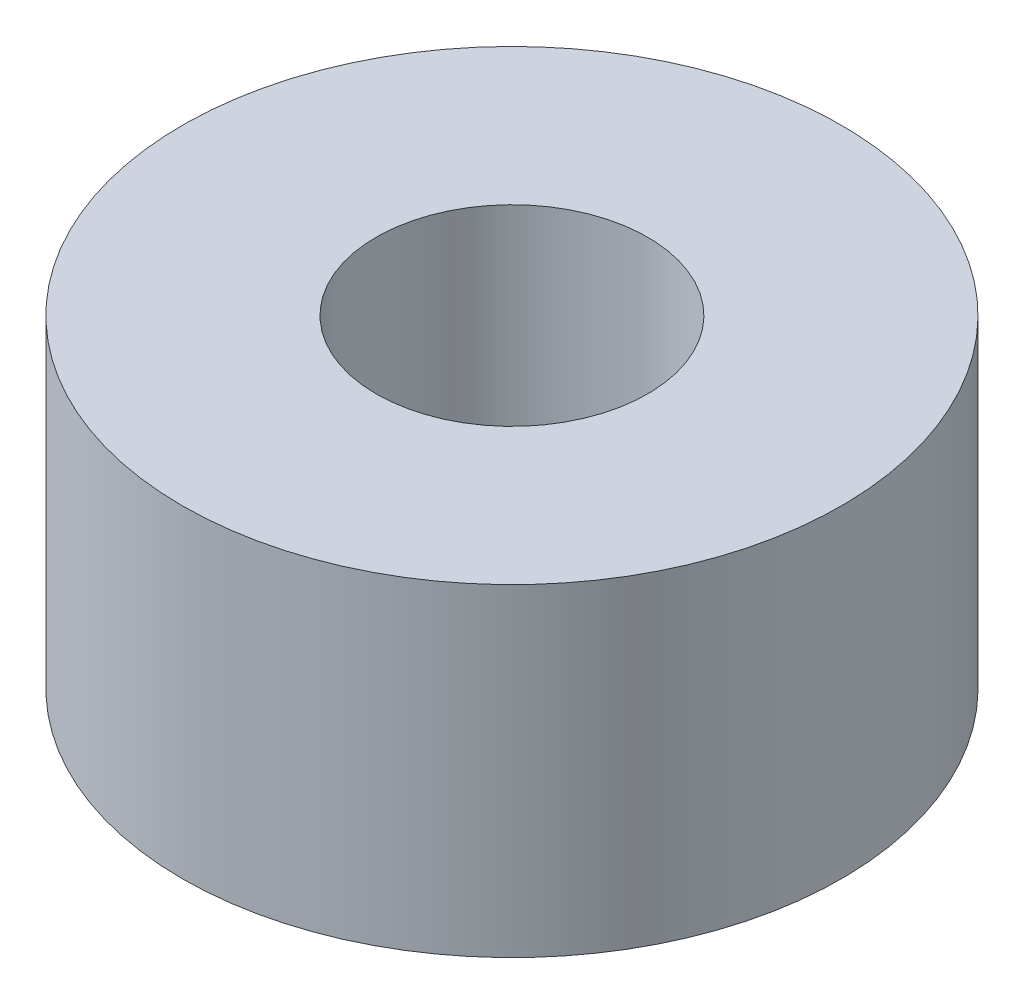
from build123d import *

# Parameters (mm, degrees)
SKETCH1_R           = 5.1016
SKETCH1_R_2         = 2.1016
BOSS_EXTRUDE1_DEPTH = 5


with BuildPart() as part:
    # Sketch1 → Boss-Extrude1 (new body)
    with BuildSketch(Plane(origin=(0, 0, 0), x_dir=(1, 0, 0), z_dir=(0, 1, 0))):
        with Locations(Location((0, 0, 0), (0, 0, 270))):
            Circle(SKETCH1_R)
        with Locations(Location((0, 0, 0), (0, 0, 270))):
            Circle(SKETCH1_R_2, mode=Mode.SUBTRACT)
    extrude(amount=BOSS_EXTRUDE1_DEPTH)


solid = part.part
